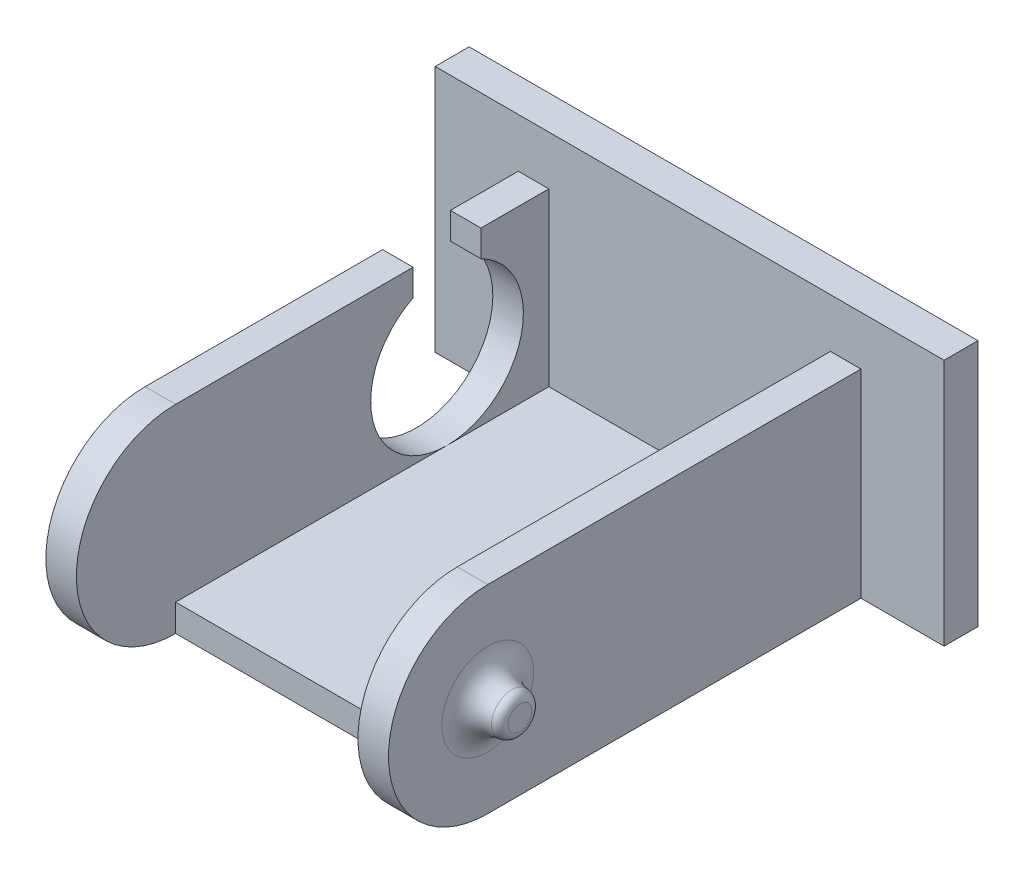
from build123d import *

# Parameters (mm, degrees)
SKETCH1_W           = 20.2
SKETCH1_H           = 12
BOSS_EXTRUDE1_DEPTH = 1.6
BOSS_EXTRUDE2_DEPTH = 1.8
SKETCH3_R           = 1.2
BOSS_EXTRUDE3_DEPTH = 1.9
FILLET1_R           = 1.5
FILLET2_R           = 0.5
FILLET3_R           = 1.5
FILLET4_R           = 0.5
BOSS_EXTRUDE4_DEPTH = 10
SKETCH5_W           = 30
SKETCH5_H           = 17.5
BOSS_EXTRUDE5_DEPTH = 2
CUT_EXTRUDE1_DEPTH  = 2
SKETCH8_W           = 30
SKETCH8_H           = 2.9
CUT_EXTRUDE3_DEPTH  = 2


with BuildPart() as part:
    # Sketch1 → Boss-Extrude1 (new body)
    with BuildSketch(Plane(origin=(0, 0, 0), x_dir=(1, 0, 0), z_dir=(0, 1, 0))):
        Rectangle(SKETCH1_W, SKETCH1_H)
    extrude(amount=BOSS_EXTRUDE1_DEPTH)

    # Sketch2 → Boss-Extrude2 (add)
    with BuildSketch(Plane(origin=(10.1, 0, 0), x_dir=(0, 0, -1), z_dir=(1, 0, 0))):
        with BuildLine():
            Line((-6, 11.7), (6, 11.7))
            Line((6, 11.7), (6, 0))
            Line((6, 0), (-6, 0))
            ThreePointArc((-6, 0), (-11.85, 5.85), (-6, 11.7))
        make_face()
    boss_extrude2 = extrude(amount=-BOSS_EXTRUDE2_DEPTH)

    # Sketch3 → Boss-Extrude3 (add)
    with BuildSketch(Plane(origin=(10.1, 0, 0), x_dir=(0, 0, -1), z_dir=(1, 0, 0))):
        with Locations(Location((-6, 5.85, 0), (0, 0, 180))):
            Circle(SKETCH3_R)
    boss_extrude3 = extrude(amount=BOSS_EXTRUDE3_DEPTH)

    # Fillet1
    fillet1_edges = [part.edges().sort_by_distance(p)[0] for p in [
        (10.1, 5.85, 4.8),
    ]]
    fillet(fillet1_edges, radius=FILLET1_R)

    # Fillet2
    fillet2_edges = [part.edges().sort_by_distance(p)[0] for p in [
        (12, 5.85, 4.8),
    ]]
    fillet(fillet2_edges, radius=FILLET2_R)

    # Mirror2: Boss-Extrude2, Boss-Extrude3 across plane
    add(boss_extrude2.mirror(Plane(origin=(0, 0, 0), x_dir=(0, 0, 1), z_dir=(1, 0, 0))))
    add(boss_extrude3.mirror(Plane(origin=(0, 0, 0), x_dir=(0, 0, 1), z_dir=(1, 0, 0))))

    # Fillet3
    fillet3_edges = [part.edges().sort_by_distance(p)[0] for p in [
        (-10.1, 5.85, 4.8),
    ]]
    fillet(fillet3_edges, radius=FILLET3_R)

    # Fillet4
    fillet4_edges = [part.edges().sort_by_distance(p)[0] for p in [
        (-12, 5.85, 4.8),
    ]]
    fillet(fillet4_edges, radius=FILLET4_R)

    # Sketch4 → Boss-Extrude4 (add)
    with BuildSketch(Plane(origin=(0, 0, -6), x_dir=(-1, 0, 0), z_dir=(0, 0, -1))):
        Polygon((10.1, 0), (10.1, 11.7), (8.3, 11.7), (8.3, 1.6), (-8.3, 1.6), (-8.3, 11.7), (-10.1, 11.7), (-10.1, 0), align=None)
    extrude(amount=BOSS_EXTRUDE4_DEPTH)

    # Sketch5 → Boss-Extrude5 (add)
    with BuildSketch(Plane(origin=(0, 0, -16), x_dir=(-1, 0, 0), z_dir=(0, 0, -1))):
        with Locations((0, 5.85)):
            Rectangle(SKETCH5_W, SKETCH5_H)
    extrude(amount=BOSS_EXTRUDE5_DEPTH)

    # Sketch7 → Cut-Extrude1 (cut)
    with BuildSketch(Plane(origin=(-8.3, 0, 0), x_dir=(0, 0, -1), z_dir=(1, 0, 0))):
        with BuildLine():
            Line((8, 11.7), (12, 11.7))
            Line((12, 11.7), (12, 10.131128874))
            ThreePointArc((12, 10.131128874), (10, 1.6), (8, 10.131128874))
            Line((8, 10.131128874), (8, 11.7))
        make_face()
    extrude(amount=-CUT_EXTRUDE1_DEPTH, mode=Mode.SUBTRACT)

    # Sketch8 → Cut-Extrude3 (cut)
    with BuildSketch(Plane(origin=(0, 0, -18), x_dir=(-1, 0, 0), z_dir=(0, 0, -1))):
        with Locations((0, -1.45)):
            Rectangle(SKETCH8_W, SKETCH8_H)
    extrude(amount=-CUT_EXTRUDE3_DEPTH, mode=Mode.SUBTRACT)


solid = part.part
